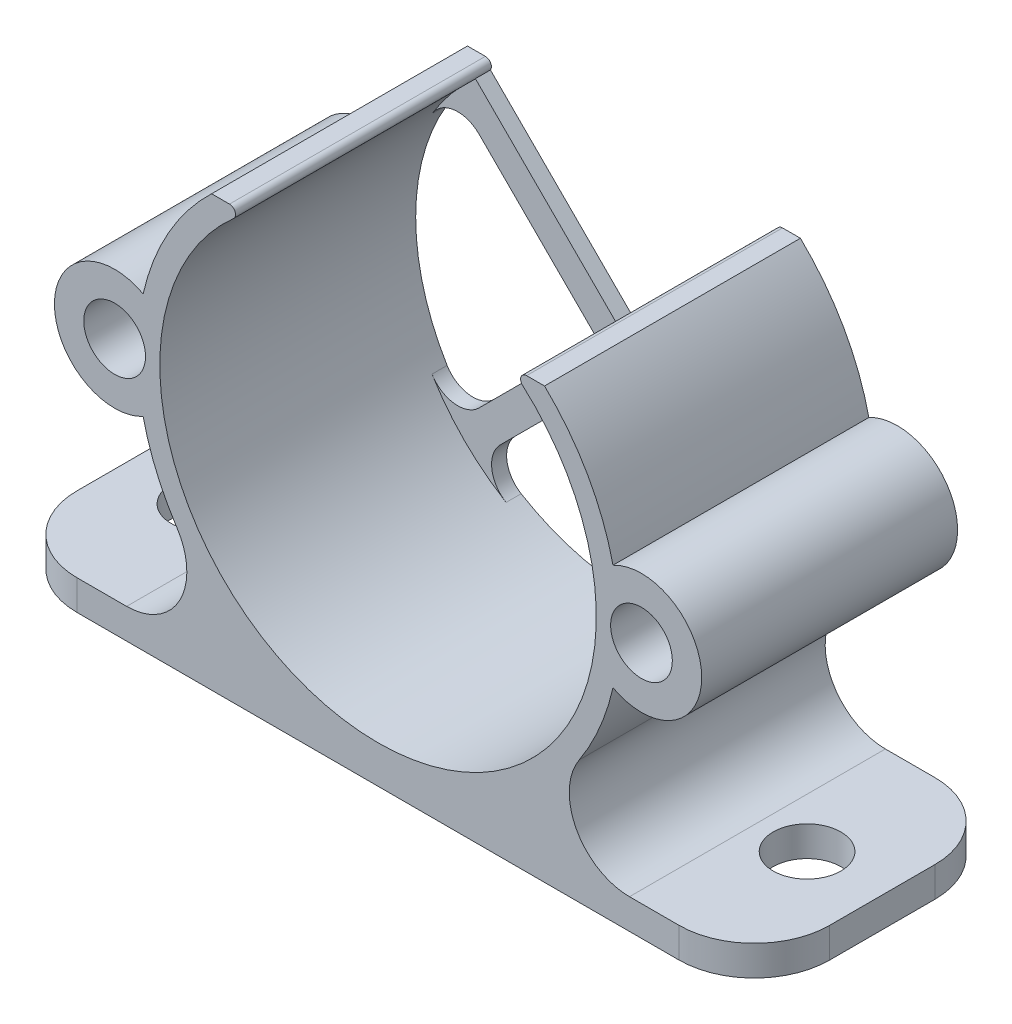
from build123d import *

# Parameters (mm, degrees)
ESQUISSE1_R             = 2.05
BOSS_EXTRU_2_DEPTH      = 17
ESQUISSE2_W             = 50
ESQUISSE2_H             = 2
BOSS_EXTRU_3_DEPTH      = 17
CONG_2_R                = 4
BOSS_EXTRU_4_DEPTH      = 1
CONG_3_R                = 0.4
CONG_4_R                = 2
ESQUISSE5_R             = 2.25
ENL_V_MAT_EXTRU_1_DEPTH = 2
CONG_5_R                = 5


with BuildPart() as part:
    # Esquisse1 → Boss.-Extru.2 (new body)
    with BuildSketch(Plane.XY):
        with BuildLine():
            Line((-8.75, 11.56233108), (-11.05949818, 11.56233108))
            ThreePointArc((-11.05949818, 11.56233108), (-13.925946075, 7.87832634), (-15.607142857, 3.523789414))
            ThreePointArc((-15.607142857, 3.523789414), (-21.5, 0), (-15.607142857, -3.523789414))
            ThreePointArc((-15.607142857, -3.523789414), (0, -16), (15.607142857, -3.523789414))
            ThreePointArc((15.607142857, -3.523789414), (21.5, 0), (15.607142857, 3.523789414))
            ThreePointArc((15.607142857, 3.523789414), (13.925946075, 7.87832634), (11.05949818, 11.56233108))
            Line((11.05949818, 11.56233108), (8.75, 11.56233108))
            ThreePointArc((8.75, 11.56233108), (0, -14.5), (-8.75, 11.56233108))
        make_face()
        with Locations((-17.5, 0)):
            Circle(ESQUISSE1_R, mode=Mode.SUBTRACT)
        with Locations((17.5, 0)):
            Circle(ESQUISSE1_R, mode=Mode.SUBTRACT)
    extrude(amount=BOSS_EXTRU_2_DEPTH)

    # Esquisse2 → Boss.-Extru.3 (add)
    with BuildSketch(Plane.XY.offset(17)):
        with Locations((0, -16)):
            Rectangle(ESQUISSE2_W, ESQUISSE2_H)
    extrude(amount=-BOSS_EXTRU_3_DEPTH)

    # Congé2
    cong_2_edges = [part.edges().sort_by_distance(p)[0] for p in [
        (5.567764363, -15, 8.5),
        (-5.567764363, -15, 8.5),
    ]]
    fillet(cong_2_edges, radius=CONG_2_R)

    # Esquisse4 → Boss.-Extru.4 (add)
    with BuildSketch(Plane(origin=(0, 0, 0), x_dir=(-1, 0, 0), z_dir=(0, 0, -1))):
        with BuildLine():
            Line((-1.414213562, 0), (-10.935743054, -9.521529492))
            ThreePointArc((-10.935743054, -9.521529492), (-10.600707524, -9.893179469), (-10.253048327, -10.253048327))
            ThreePointArc((-10.253048327, -10.253048327), (-9.893179469, -10.600707524), (-9.521529492, -10.935743054))
            Line((-9.521529492, -10.935743054), (0, -1.414213562))
            Line((0, -1.414213562), (9.521529492, -10.935743054))
            ThreePointArc((9.521529492, -10.935743054), (9.893179469, -10.600707524), (10.253048327, -10.253048327))
            ThreePointArc((10.253048327, -10.253048327), (10.600707524, -9.893179469), (10.935743054, -9.521529492))
            Line((10.935743054, -9.521529492), (1.414213562, 0))
            Line((1.414213562, 0), (10.935743054, 9.521529492))
            ThreePointArc((10.935743054, 9.521529492), (10.600707524, 9.893179469), (10.253048327, 10.253048327))
            ThreePointArc((10.253048327, 10.253048327), (9.893179469, 10.600707524), (9.521529492, 10.935743054))
            Line((9.521529492, 10.935743054), (0, 1.414213562))
            Line((0, 1.414213562), (-9.521529492, 10.935743054))
            ThreePointArc((-9.521529492, 10.935743054), (-10.253048327, 10.253048327), (-10.935743054, 9.521529492))
            Line((-10.935743054, 9.521529492), (-1.414213562, 0))
        make_face()
    extrude(amount=-BOSS_EXTRU_4_DEPTH)

    # Congé3
    cong_3_edges = [part.edges().sort_by_distance(p)[0] for p in [
        (-8.75, 11.56233108, 8.5),
        (8.75, 11.56233108, 8.5),
    ]]
    fillet(cong_3_edges, radius=CONG_3_R)

    # Congé4
    cong_4_edges = [part.edges().sort_by_distance(p)[0] for p in [
        (-10.935743054, -9.521529492, 0.5),
        (-9.521529492, -10.935743054, 0.5),
        (9.521529492, -10.935743054, 0.5),
        (10.935743054, -9.521529492, 0.5),
        (10.935743054, 9.521529492, 0.5),
        (-10.935743054, 9.521529492, 0.5),
    ]]
    fillet(cong_4_edges, radius=CONG_4_R)

    # Esquisse5 → Enlèv. mat.-Extru.1 (cut)
    with BuildSketch(Plane.XZ.offset(17)):
        with Locations(Location((-20, 8.5, 0), (0, 0, 270))):
            Circle(ESQUISSE5_R)
        with Locations(Location((20, 8.5, 0), (0, 0, 270))):
            Circle(ESQUISSE5_R)
    extrude(amount=-ENL_V_MAT_EXTRU_1_DEPTH, mode=Mode.SUBTRACT)

    # Congé5
    cong_5_edges = [part.edges().sort_by_distance(p)[0] for p in [
        (-25, -16, 17),
        (25, -16, 17),
        (-25, -16, 0),
        (25, -16, 0),
    ]]
    fillet(cong_5_edges, radius=CONG_5_R)


solid = part.part
